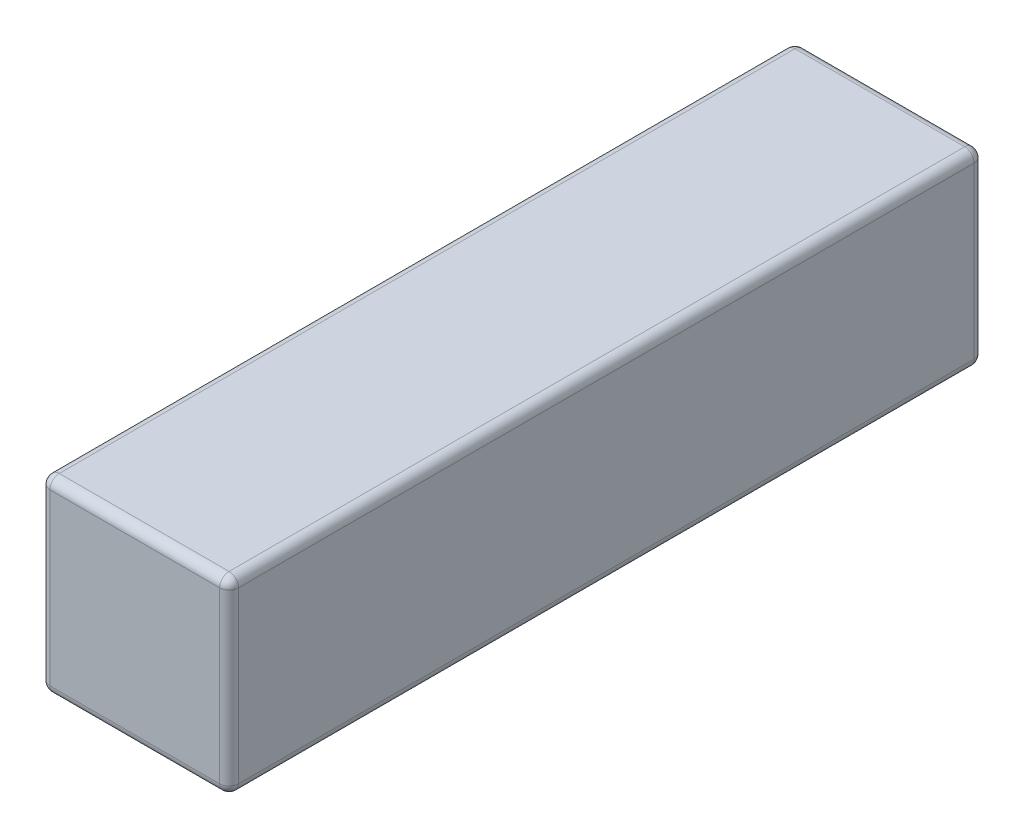
from build123d import *

# Parameters (mm, degrees)
BOSS_EXTRUDE1_DEPTH      = 6
BOSS_EXTRUDE1_DEPTH_BACK = 6
SKETCH3_W                = 3
SKETCH3_H                = 3
FILLET2_R                = 0.15


with BuildPart() as part:
    # Sketch3 → Boss-Extrude1 (new, two sides: drawn at the far end of the back side and taken through both)
    with BuildSketch(Plane.XY.offset(-BOSS_EXTRUDE1_DEPTH_BACK)):
        Rectangle(SKETCH3_W, SKETCH3_H)
    extrude(amount=BOSS_EXTRUDE1_DEPTH + BOSS_EXTRUDE1_DEPTH_BACK)

    # Fillet2
    fillet2_edges = [part.edges().sort_by_distance(p)[0] for p in [
        (0, 1.5, 6),
        (0, -1.5, -6),
        (-1.5, 0, -6),
        (0, 1.5, -6),
        (1.5, 0, -6),
        (-1.5, 0, 6),
        (0, -1.5, 6),
        (1.5, 0, 6),
        (-1.5, -1.5, 0),
        (-1.5, 1.5, 0),
        (1.5, 1.5, 0),
        (1.5, -1.5, 0),
    ]]
    fillet(fillet2_edges, radius=FILLET2_R)


solid = part.part
